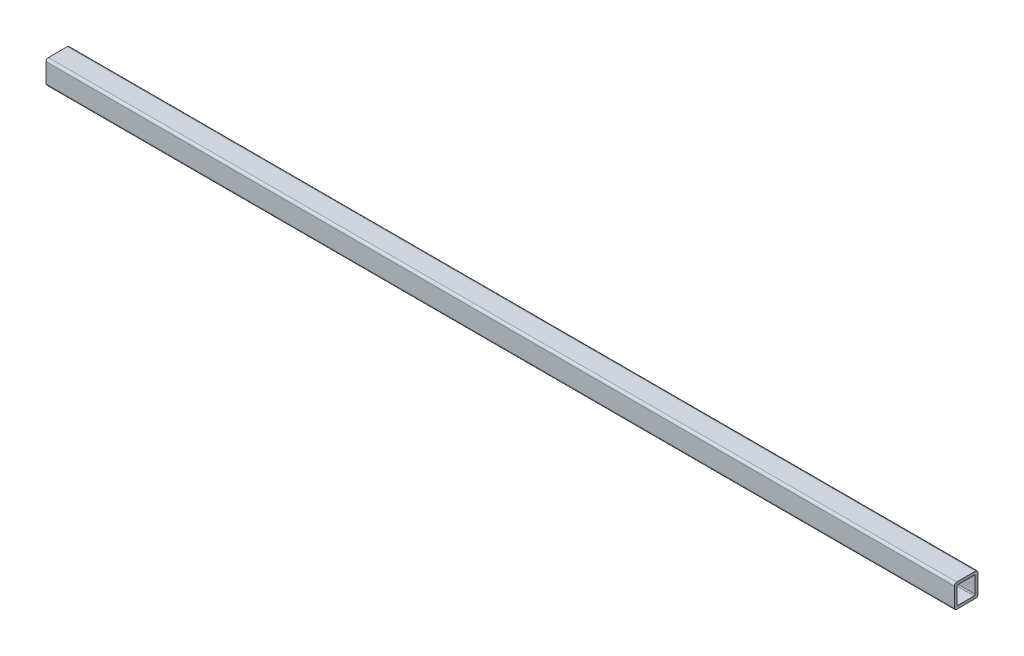
from build123d import *

# Parameters (mm, degrees)
SKETCH3_W           = 25.4
SKETCH3_H           = 25.4
SKETCH3_W_2         = 19.304
SKETCH3_H_2         = 19.304
BOSS_EXTRUDE1_DEPTH = 974.6
FILLET1_R           = 2.5
FILLET2_R           = 1


with BuildPart() as part:
    # Sketch3 → Boss-Extrude1 (new body)
    with BuildSketch(Plane(origin=(0, 0, 0), x_dir=(0, 0, -1), z_dir=(1, 0, 0))):
        Rectangle(SKETCH3_W, SKETCH3_H)
        Rectangle(SKETCH3_W_2, SKETCH3_H_2, mode=Mode.SUBTRACT)
    extrude(amount=-BOSS_EXTRUDE1_DEPTH)

    # Fillet1
    fillet1_edges = [part.edges().sort_by_distance(p)[0] for p in [
        (-487.3, -12.7, -12.7),
        (-487.3, -12.7, 12.7),
        (-487.3, 12.7, 12.7),
        (-487.3, 12.7, -12.7),
    ]]
    fillet(fillet1_edges, radius=FILLET1_R)

    # Fillet2
    fillet2_edges = [part.edges().sort_by_distance(p)[0] for p in [
        (-487.3, 9.652, -9.652),
        (-487.3, -9.652, -9.652),
        (-487.3, -9.652, 9.652),
        (-487.3, 9.652, 9.652),
    ]]
    fillet(fillet2_edges, radius=FILLET2_R)


solid = part.part
